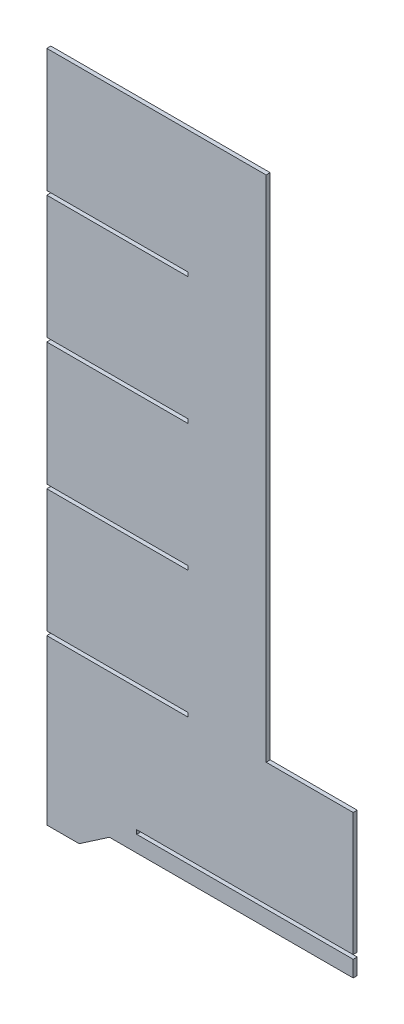
from build123d import *

# Parameters (mm, degrees)
BOSS_EXTRUDE2_DEPTH = 3.175
SKETCH4_W           = 24.39416
SKETCH4_H           = 495.5921
BOSS_EXTRUDE3_DEPTH = 3.175
BOSS_EXTRUDE6_DEPTH = 3.175
SKETCH8_W           = 68.31584
SKETCH8_H           = 12.7
SKETCH8_H_2         = 96.57842
BOSS_EXTRUDE7_DEPTH = 3.175


with BuildPart() as part:
    # Sketch1 → Boss-Extrude2 (new body)
    with BuildSketch(Plane.XY):
        Polygon((129.013076168, 254.245404572), (-18.685383832, 254.245404572), (-18.685383832, 157.666984572), (92.088461168, 157.666984572), (92.088461168, 154.491984572), (-18.685383832, 154.491984572), (-18.685383832, 57.913564572), (92.088461168, 57.913564572), (92.088461168, 54.738564572), (-18.685383832, 54.738564572), (-18.685383832, -41.839855428), (92.088461168, -41.839855428), (92.088461168, -45.014855428), (-18.685383832, -45.014855428), (-18.685383832, -141.593275428), (92.088461168, -141.593275428), (92.088461168, -144.768275428), (-18.685383832, -144.768275428), (-18.685383832, -241.346695428), (129.013076168, -241.346695428), align=None)
    extrude(amount=BOSS_EXTRUDE2_DEPTH)

    # Sketch4 → Boss-Extrude3 (add, through all)
    with BuildSketch(Plane.XY.offset(3.175)):
        with Locations((141.210156168, 6.449354572)):
            Rectangle(SKETCH4_W, SKETCH4_H)
    extrude(amount=-BOSS_EXTRUDE3_DEPTH)

    # Sketch7 → Boss-Extrude6 (add, through all)
    with BuildSketch(Plane.XY.offset(3.175)):
        Polygon((51.807236168, -241.346695428), (-18.685383832, -241.346695428), (-18.685383832, -273.477695428), (6.714616168, -273.477695428), (30.496305109, -257.221695428), (153.407236168, -257.221695428), (153.407236168, -244.521695428), (51.807236168, -244.521695428), align=None)
    extrude(amount=-BOSS_EXTRUDE6_DEPTH)

    # Sketch8 → Boss-Extrude7 (add, through all)
    with BuildSketch(Plane.XY.offset(3.175)):
        with Locations((187.565156168, -250.871695428)):
            Rectangle(SKETCH8_W, SKETCH8_H)
        with Locations((187.565156168, -193.057485428)):
            Rectangle(SKETCH8_W, SKETCH8_H_2)
    extrude(amount=-BOSS_EXTRUDE7_DEPTH)


solid = part.part
